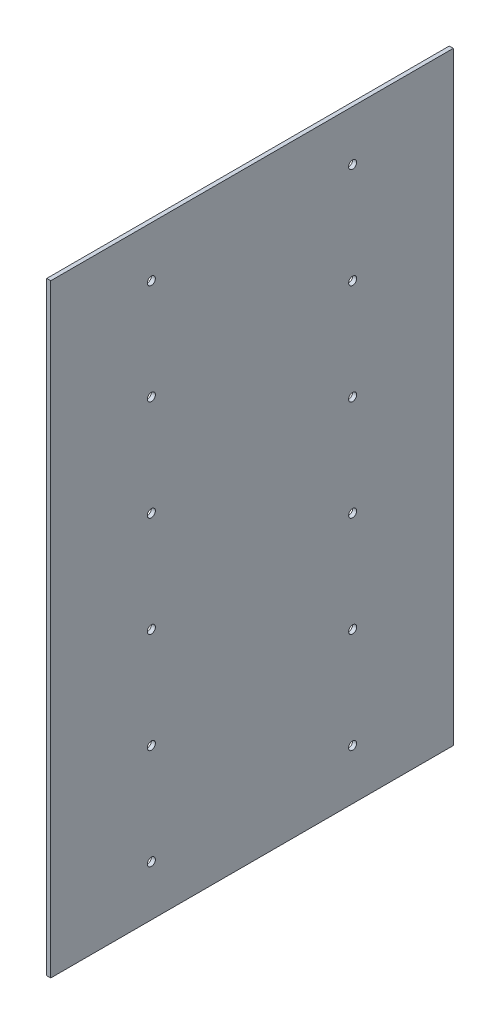
from build123d import *

# Parameters (mm, degrees)
SKETCH_1_W          = 200
SKETCH_1_H          = 300
EXTRUDE_1_DEPTH     = 2
SKETCH_2_R          = 2
CUT_EXTRUDE_1_DEPTH = 2


with BuildPart() as part:
    # Эскиз1 → Бобышка-Вытянуть1 (new body)
    with BuildSketch(Plane(origin=(0, 0, 0), x_dir=(0, 0, -1), z_dir=(1, 0, 0))):
        Rectangle(SKETCH_1_W, SKETCH_1_H)
    extrude(amount=EXTRUDE_1_DEPTH)

    # Эскиз2 → Вырез-Вытянуть1 (cut)
    with BuildSketch(Plane(origin=(2, 0, 0), x_dir=(0, 0, -1), z_dir=(1, 0, 0))):
        with Locations((-50, 125)):
            Circle(SKETCH_2_R)
        with Locations((50, 125)):
            Circle(SKETCH_2_R)
        with Locations((50, -125)):
            Circle(SKETCH_2_R)
        with Locations((-50, -125)):
            Circle(SKETCH_2_R)
        with Locations((-50, 75)):
            Circle(SKETCH_2_R)
        with Locations((-50, 25)):
            Circle(SKETCH_2_R)
        with Locations((50, 25)):
            Circle(SKETCH_2_R)
        with Locations((50, 75)):
            Circle(SKETCH_2_R)
        with Locations((-50, -25)):
            Circle(SKETCH_2_R)
        with Locations((50, -25)):
            Circle(SKETCH_2_R)
        with Locations((50, -75)):
            Circle(SKETCH_2_R)
        with Locations((-50, -75)):
            Circle(SKETCH_2_R)
    extrude(amount=-CUT_EXTRUDE_1_DEPTH, mode=Mode.SUBTRACT)


solid = part.part
